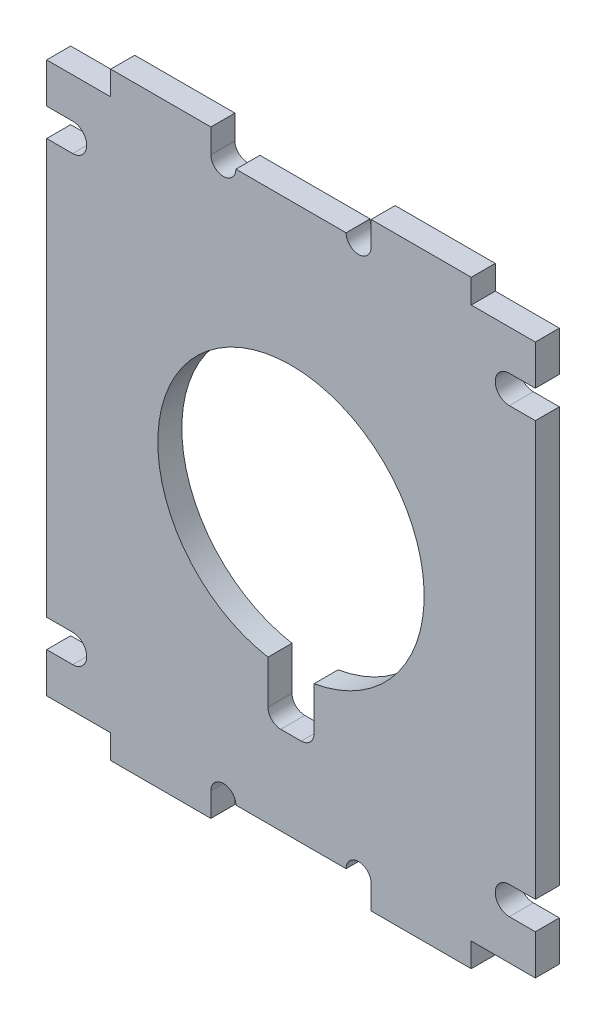
from build123d import *

# Parameters (mm, degrees)
SKETCH1_W               = 30.988
SKETCH1_H               = 34.925
BOSS_EXTRUDE1_DEPTH     = 1.524
SKETCH2_R               = 8.4455
CUT_EXTRUDE1_DEPTH      = 24.39498917
CUT_EXTRUDE2_DEPTH      = 24.39498917
SKETCH4_W               = 6.35
SKETCH4_H               = 1.524
BOSS_EXTRUDE2_DEPTH     = 1.524
SKETCH4_3_R             = 0.79375
CUT_EXTRUDE3_DEPTH      = 25.553488433
MIRROR4_COPY_1_DEPTH    = 24.39498917
MIRROR4_COPY_2_SKETCH_W = 6.35
MIRROR4_COPY_2_SKETCH_H = 1.524
MIRROR4_COPY_2_DEPTH    = 1.524
MIRROR4_COPY_3_SKETCH_R = 0.79375
MIRROR4_COPY_3_DEPTH    = 25.553488433


with BuildPart() as part:
    # Sketch1 → Boss-Extrude1 (new body)
    with BuildSketch(Plane.XY):
        Rectangle(SKETCH1_W, SKETCH1_H)
    extrude(amount=BOSS_EXTRUDE1_DEPTH)

    # Sketch2 → Cut-Extrude1 (cut, through all)
    with BuildSketch(Plane.XY.offset(1.524)):
        Circle(SKETCH2_R)
        with BuildLine():
            ThreePointArc((1.4605, -8.31825763), (0, -8.4455), (-1.4605, -8.31825763))
            Line((-1.4605, -8.31825763), (-1.4605, -11.0617))
            ThreePointArc((-1.4605, -11.0617), (-1.222436392, -11.636436392), (-0.6477, -11.8745))
            Line((-0.6477, -11.8745), (0.6477, -11.8745))
            ThreePointArc((0.6477, -11.8745), (1.222436392, -11.636436392), (1.4605, -11.0617))
            Line((1.4605, -11.0617), (1.4605, -8.31825763))
        make_face()
    extrude(amount=-CUT_EXTRUDE1_DEPTH, mode=Mode.SUBTRACT)

    # Sketch3 → Cut-Extrude2 (cut, through all)
    with BuildSketch(Plane.XY.offset(1.524)):
        with BuildLine():
            Line((15.494, 13.1445), (13.843, 13.1445))
            ThreePointArc((13.843, 13.1445), (12.954, 14.0335), (13.843, 14.9225))
            Line((13.843, 14.9225), (15.494, 14.9225))
            ThreePointArc((15.494, 14.9225), (16.383, 14.0335), (15.494, 13.1445))
        make_face()
    cut_extrude2 = extrude(amount=-CUT_EXTRUDE2_DEPTH, mode=Mode.SUBTRACT)

    # Sketch4 → Boss-Extrude2 (add)
    with BuildSketch(Plane.XY.offset(1.524)):
        with Locations((8.255, 18.2245)):
            Rectangle(SKETCH4_W, SKETCH4_H)
    boss_extrude2 = extrude(amount=-BOSS_EXTRUDE2_DEPTH)

    # Sketch4<3> → Cut-Extrude3 (cut, through all)
    with BuildSketch(Plane.XY.offset(1.524)):
        with Locations((4.28625, 17.4625)):
            Circle(SKETCH4_3_R)
    cut_extrude3 = extrude(amount=-CUT_EXTRUDE3_DEPTH, mode=Mode.SUBTRACT)

    # Mirror3: Cut-Extrude2, Boss-Extrude2, Cut-Extrude3 across plane
    add(cut_extrude2.mirror(Plane.ZX), mode=Mode.SUBTRACT)
    add(boss_extrude2.mirror(Plane.ZX))
    add(cut_extrude3.mirror(Plane.ZX), mode=Mode.SUBTRACT)

    # Mirror4: Cut-Extrude2, Boss-Extrude2, Cut-Extrude3 across plane
    add(cut_extrude2.mirror(Plane(origin=(0, 0, 0), x_dir=(0, 0, 1), z_dir=(1, 0, 0))), mode=Mode.SUBTRACT)
    add(boss_extrude2.mirror(Plane(origin=(0, 0, 0), x_dir=(0, 0, 1), z_dir=(1, 0, 0))))
    add(cut_extrude3.mirror(Plane(origin=(0, 0, 0), x_dir=(0, 0, 1), z_dir=(1, 0, 0))), mode=Mode.SUBTRACT)

    # Mirror4 copy 1 sketch → Mirror4 copy 1 (cut, through all)
    with BuildSketch(Plane(origin=(0, 0, 1.524), x_dir=(-1, 0, 0), z_dir=(0, 0, 1))):
        with BuildLine():
            Line((15.494, 13.1445), (13.843, 13.1445))
            ThreePointArc((13.843, 13.1445), (12.954, 14.0335), (13.843, 14.9225))
            Line((13.843, 14.9225), (15.494, 14.9225))
            ThreePointArc((15.494, 14.9225), (16.383, 14.0335), (15.494, 13.1445))
        make_face()
    extrude(amount=-MIRROR4_COPY_1_DEPTH, mode=Mode.SUBTRACT)

    # Mirror4 copy 2 sketch → Mirror4 copy 2 (add)
    with BuildSketch(Plane(origin=(0, 0, 1.524), x_dir=(-1, 0, 0), z_dir=(0, 0, 1))):
        with Locations((8.255, 18.2245)):
            Rectangle(MIRROR4_COPY_2_SKETCH_W, MIRROR4_COPY_2_SKETCH_H)
    extrude(amount=-MIRROR4_COPY_2_DEPTH)

    # Mirror4 copy 3 sketch → Mirror4 copy 3 (cut, through all)
    with BuildSketch(Plane(origin=(0, 0, 1.524), x_dir=(-1, 0, 0), z_dir=(0, 0, 1))):
        with Locations((4.28625, 17.4625)):
            Circle(MIRROR4_COPY_3_SKETCH_R)
    extrude(amount=-MIRROR4_COPY_3_DEPTH, mode=Mode.SUBTRACT)


solid = part.part
